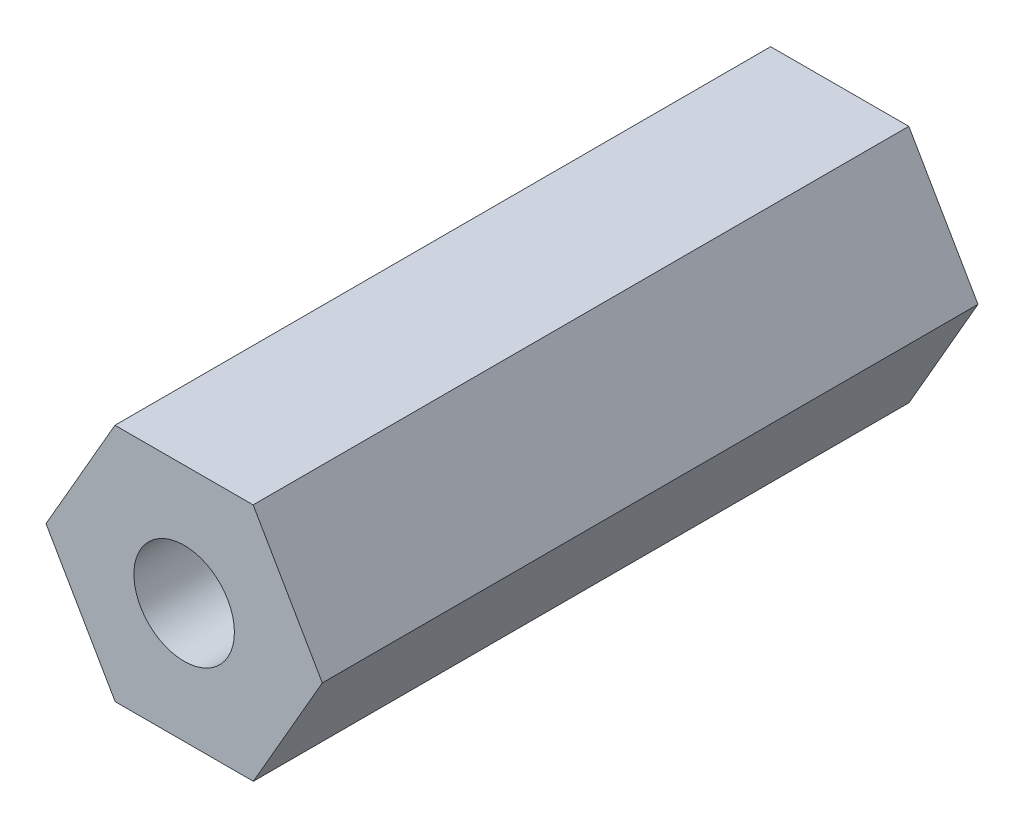
from build123d import *

# Parameters (mm, degrees)
SKETCH1_R           = 2.667
BOSS_EXTRUDE1_DEPTH = 34.798


with BuildPart() as part:
    # Sketch1 → Boss-Extrude1 (new body)
    with BuildSketch(Plane.XY):
        Polygon((3.671985369, -6.006642733), (7.332345347, 0.346710568), (3.660359978, 6.693351946), (-3.671985369, 6.686640024), (-7.332345347, 0.333286723), (-3.660359978, -6.013354656), align=None)
        with Locations((0, 0.339998645)):
            Circle(SKETCH1_R, mode=Mode.SUBTRACT)
    extrude(amount=BOSS_EXTRUDE1_DEPTH)


solid = part.part
